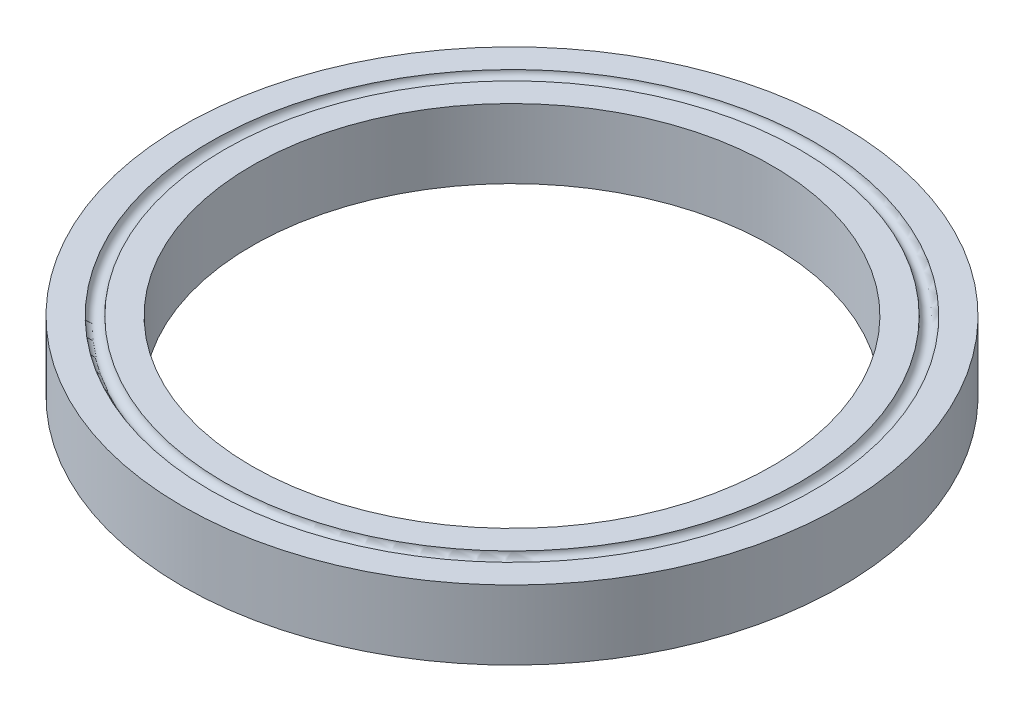
from build123d import *


with BuildPart() as part:
    # 草图1 → 旋转1 (revolve)
    with BuildSketch(Plane.XY, mode=Mode.PRIVATE) as revolve_1_sk:
        with BuildLine():
            Line((37.5, 0), (41.5, 0))
            ThreePointArc((41.5, 0), (42.5, -1), (43.5, 0))
            Line((43.5, 0), (47.5, 0))
            Line((47.5, 0), (47.5, -10))
            Line((47.5, -10), (43.5, -10))
            ThreePointArc((43.5, -10), (42.5, -9), (41.5, -10))
            Line((41.5, -10), (37.5, -10))
            Line((37.5, -10), (37.5, 0))
        make_face()
    revolve(revolve_1_sk.sketch.rotate(Axis((0, 0, 0), (0, -1, 0)), 90), axis=Axis((0, 0, 0), (0, -1, 0)))


solid = part.part
